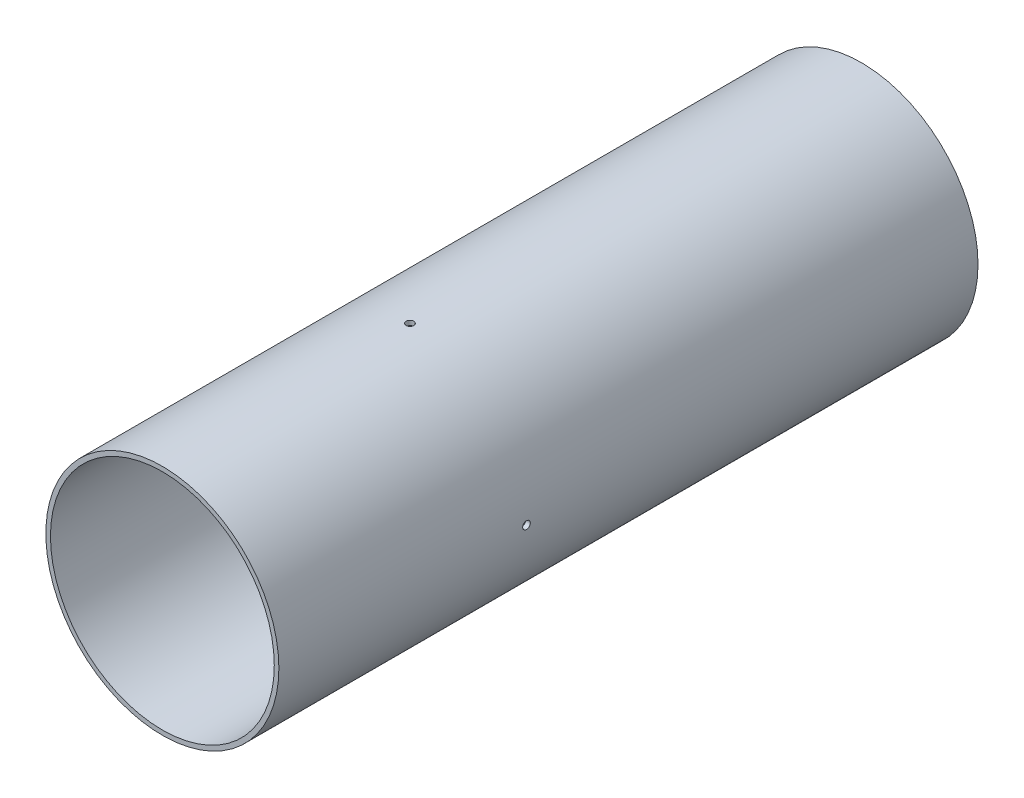
from build123d import *

# Parameters (mm, degrees)
SKETCH1_R               = 50.8
SKETCH1_R_2             = 48.7934
BOSS_EXTRUDE1_DEPTH     = 304.8
CUT_EXTRUDE1_REACH      = 327.279
CUT_EXTRUDE1_END_RADIUS = 48.7934
SKETCH2_R               = 1.651
CIRPATTERN1_COUNT       = 4


with BuildPart() as part:
    # Sketch1 → Boss-Extrude1 (new body)
    with BuildSketch(Plane.XY):
        with Locations(Location((0, 0, 0), (0, 0, 180))):
            Circle(SKETCH1_R)
        with Locations(Location((0, 0, 0), (0, 0, 180))):
            Circle(SKETCH1_R_2, mode=Mode.SUBTRACT)
    extrude(amount=BOSS_EXTRUDE1_DEPTH)

    # Cut-Extrude1: up to this cylinder (the profile starts outside it)
    cut_extrude1_end = Plane(origin=(0, 0, 196.85), z_dir=(0, 0, -1)) * Cylinder(CUT_EXTRUDE1_END_RADIUS, 753.1448, mode=Mode.PRIVATE)
    # Sketch2 → Cut-Extrude1 (cut, up to the surface)
    with BuildSketch(Plane.ZY.offset(50.8), mode=Mode.PRIVATE) as cut_extrude1_sk1:
        with Locations((196.85, 0)):
            Circle(SKETCH2_R)
    cut_extrude1_tool1 = extrude(cut_extrude1_sk1.sketch, amount=-CUT_EXTRUDE1_REACH, mode=Mode.PRIVATE) - cut_extrude1_end
    cut_extrude1 = cut_extrude1_tool1.solids().sort_by_distance((-50.8, 0, 196.85))[0]
    add(cut_extrude1, mode=Mode.SUBTRACT)

    # CirPattern1: Cut-Extrude1 ×4 about axis
    cirpattern1_axis = Axis((0, 0, 304.8), (0, 0, -1))
    for i in range(1, CIRPATTERN1_COUNT):
        add(cut_extrude1.rotate(cirpattern1_axis, i * 360 / CIRPATTERN1_COUNT), mode=Mode.SUBTRACT)


solid = part.part
